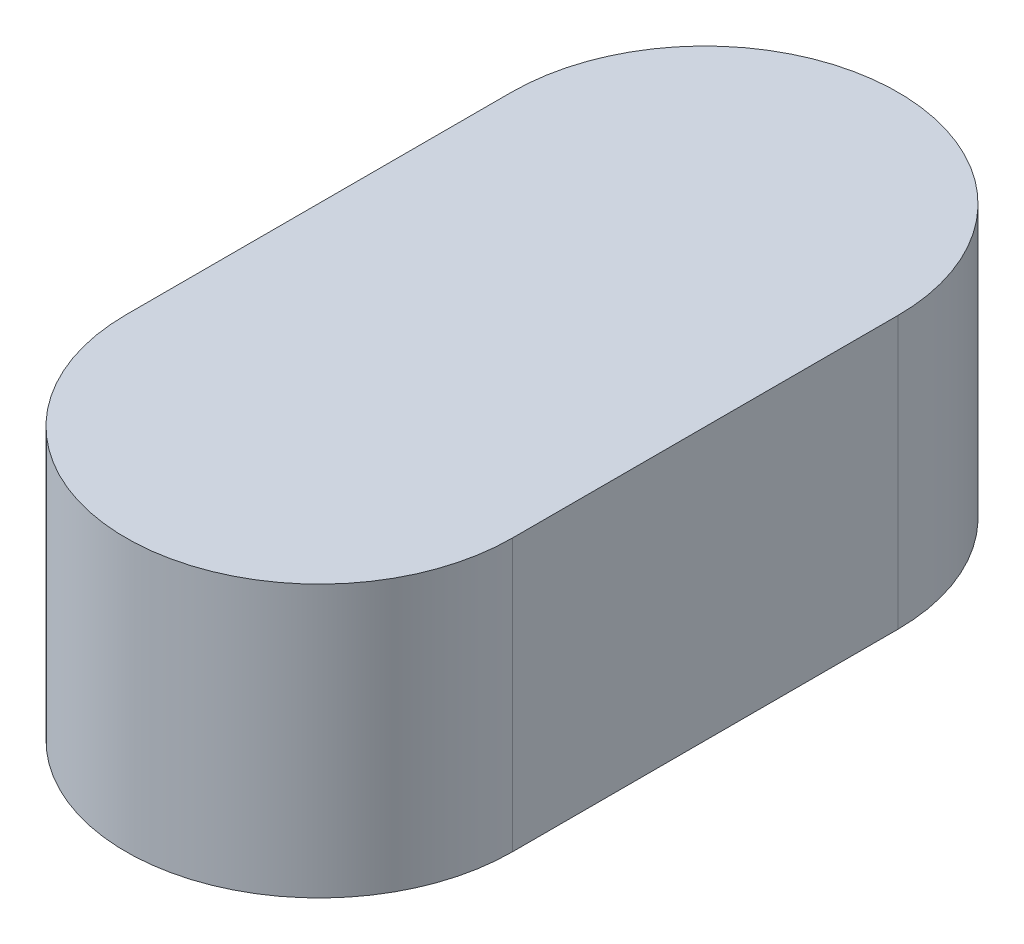
from build123d import *

# Parameters (mm, degrees)
BOSS_EXTRUDE1_DEPTH = 262.636


with BuildPart() as part:
    # Sketch2 → Boss-Extrude1 (new body)
    with BuildSketch(Plane(origin=(0, 0, 0), x_dir=(1, 0, 0), z_dir=(0, 1, 0))):
        with BuildLine():
            Line((710.127257794, -852.441149717), (710.127257794, -1224.890708062))
            ThreePointArc((710.127257794, -1224.890708062), (523.369546431, -1411.648419426), (336.611835067, -1224.890708062))
            Line((336.611835067, -1224.890708062), (336.611835067, -852.441149717))
            ThreePointArc((336.611835067, -852.441149717), (523.369546431, -665.683438353), (710.127257794, -852.441149717))
        make_face()
    extrude(amount=BOSS_EXTRUDE1_DEPTH)


solid = part.part
